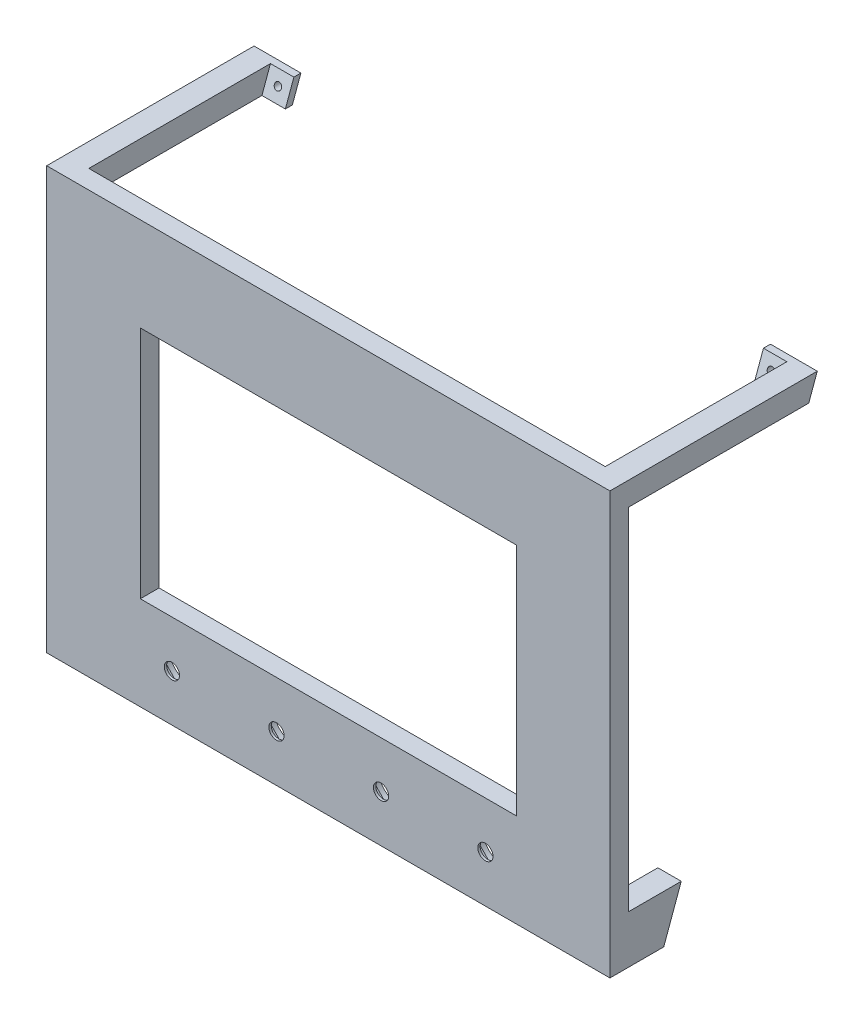
from build123d import *

# Parameters (mm, degrees)
SKETCH1_W                      = 240.6
SKETCH1_H                      = 180.2
BOSS_EXTRUDE1_DEPTH            = 8
SKETCH2_W                      = 160.6
SKETCH2_H                      = 100.2
CUT_EXTRUDE1_DEPTH             = 200.503872501
CUT_EXTRUDE2_DEPTH             = 7
CUT_EXTRUDE3_DEPTH             = 7
CUT_EXTRUDE4_DEPTH             = 7
CUT_EXTRUDE5_DEPTH             = 7
F_6_5_6_5_DIAMETER_HOLE1_D     = 6.5
F_6_5_6_5_DIAMETER_HOLE1_DEPTH = 8
SKETCH9_R                      = 9.267416037
SKETCH9_R_2                    = 9.269178346
SKETCH9_R_3                    = 9.266671768
CUT_EXTRUDE7_DEPTH             = 4
BOSS_EXTRUDE2_DEPTH            = 10
BOSS_EXTRUDE3_DEPTH            = 10
BOSS_EXTRUDE4_DEPTH            = 10
BOSS_EXTRUDE5_DEPTH            = 10
SKETCH18_W                     = 10
SKETCH18_H                     = 10.641777725
SKETCH18_R                     = 1.5
BOSS_EXTRUDE6_DEPTH            = 3


with BuildPart() as part:
    # Sketch1 → Boss-Extrude1 (new body)
    with BuildSketch(Plane(origin=(0, 0, 0), x_dir=(-1, 0, 0), z_dir=(0, 0, -1))):
        with Locations((-50.702318109, 12.34999924)):
            Rectangle(SKETCH1_W, SKETCH1_H)
    extrude(amount=-BOSS_EXTRUDE1_DEPTH)

    # Sketch2 → Cut-Extrude1 (cut, through all)
    with BuildSketch(Plane.XY.offset(8)):
        with Locations((50.702318109, 12.34999924)):
            Rectangle(SKETCH2_W, SKETCH2_H)
    extrude(amount=-CUT_EXTRUDE1_DEPTH, mode=Mode.SUBTRACT)

    # Sketch3 → Cut-Extrude2 (cut)
    with BuildSketch(Plane(origin=(0, 0, 0), x_dir=(-1, 0, 0), z_dir=(0, 0, -1))):
        Polygon((-117.686768689, -48.483328992), (-127.060792146, -58.198146757), (-117.921667286, -67.016672528), (-108.547643828, -57.301854763), align=None)
    extrude(amount=-CUT_EXTRUDE2_DEPTH, mode=Mode.SUBTRACT)

    # Sketch4 → Cut-Extrude3 (cut)
    with BuildSketch(Plane(origin=(0, 0, 0), x_dir=(-1, 0, 0), z_dir=(0, 0, -1))):
        Polygon((6.939207854, -58.198146757), (16.078332714, -67.016672528), (25.452356172, -57.301854763), (16.313231311, -48.483328992), align=None)
    extrude(amount=-CUT_EXTRUDE3_DEPTH, mode=Mode.SUBTRACT)

    # Sketch5 → Cut-Extrude4 (cut)
    with BuildSketch(Plane(origin=(0, 0, 0), x_dir=(-1, 0, 0), z_dir=(0, 0, -1))):
        Polygon((-37.727458813, -58.198146757), (-28.588333952, -67.016672528), (-19.214310494, -57.301854763), (-28.353435355, -48.483328992), align=None)
    extrude(amount=-CUT_EXTRUDE4_DEPTH, mode=Mode.SUBTRACT)

    # Sketch6 → Cut-Extrude5 (cut)
    with BuildSketch(Plane(origin=(0, 0, 0), x_dir=(-1, 0, 0), z_dir=(0, 0, -1))):
        Polygon((-82.39412548, -58.198146757), (-73.255000619, -67.016672528), (-63.880977161, -57.301854763), (-73.020102022, -48.483328992), align=None)
    extrude(amount=-CUT_EXTRUDE5_DEPTH, mode=Mode.SUBTRACT)

    # Ø6.5 (6.5) Diameter Hole1
    with Locations(Plane.XY.offset(8)):
        with Locations((117.804217987, -57.75000076), (-16.097681891, -57.75000076), (28.568984776, -57.75000076), (73.235651442, -57.75000076)):
            Hole(F_6_5_6_5_DIAMETER_HOLE1_D / 2, depth=F_6_5_6_5_DIAMETER_HOLE1_DEPTH)

    # Sketch9 → Cut-Extrude7 (cut)
    with BuildSketch(Plane(origin=(0, 0, 0), x_dir=(-1, 0, 0), z_dir=(0, 0, -1))):
        with Locations((-117.804217987, -57.75000076)):
            Circle(SKETCH9_R)
        with Locations((-73.235651442, -57.75000076)):
            Circle(SKETCH9_R_2)
        with Locations((-28.568984776, -57.75000076)):
            Circle(SKETCH9_R_2)
        with Locations((16.097681891, -57.75000076)):
            Circle(SKETCH9_R_3)
    extrude(amount=-CUT_EXTRUDE7_DEPTH, mode=Mode.SUBTRACT)

    # Sketch12 → Boss-Extrude2 (add)
    with BuildSketch(Plane(origin=(171.002318109, 0, 0), x_dir=(0, 0, -1), z_dir=(1, 0, 0))):
        Polygon((0, -77.75000076), (15, -77.75000076), (22.478199259, -57.203817156), (0, -57.203817156), align=None)
    extrude(amount=-BOSS_EXTRUDE2_DEPTH)

    # Sketch14 → Boss-Extrude3 (add)
    with BuildSketch(Plane.ZY.offset(69.597681891)):
        Polygon((-22.478199259, -57.203817156), (-15, -77.75000076), (0, -77.75000076), (0, -57.203817156), align=None)
    extrude(amount=-BOSS_EXTRUDE3_DEPTH)

    # Sketch15 → Boss-Extrude4 (add)
    with BuildSketch(Plane.ZY.offset(69.597681891)):
        Polygon((0, 102.44999924), (-80.587436215, 102.44999924), (-76.947733872, 92.44999924), (0, 92.44999924), align=None)
    extrude(amount=-BOSS_EXTRUDE4_DEPTH)

    # Sketch16 → Boss-Extrude5 (add)
    with BuildSketch(Plane(origin=(171.002318109, 0, 0), x_dir=(0, 0, -1), z_dir=(1, 0, 0))):
        Polygon((0, 102.44999924), (80.587436215, 102.44999924), (76.947733872, 92.44999924), (0, 92.44999924), align=None)
    extrude(amount=-BOSS_EXTRUDE5_DEPTH)

    # Sketch18 → Boss-Extrude6 (add, along a direction that is not the sketch's normal)
    # profile 1 of 2: a face of its own
    with BuildSketch(Plane(origin=(0, -13.915929435, -38.233701894), x_dir=(-1, 0, 0), z_dir=(0, -0.3420201433256657, -0.9396926207859096))):
        with Locations((54.597681891, 118.513145908)):
            Rectangle(SKETCH18_W, SKETCH18_H)
        with Locations((54.597681891, 118.513145907)):
            Circle(SKETCH18_R, mode=Mode.SUBTRACT)
    # profile 2 of 2: a face of its own
    with BuildSketch(Plane(origin=(0, -13.915929435, -38.233701894), x_dir=(-1, 0, 0), z_dir=(0, -0.3420201433256657, -0.9396926207859096))):
        with Locations((-156.002318109, 118.513145908)):
            Rectangle(SKETCH18_W, SKETCH18_H)
        with Locations((-156.002318109, 118.513145907)):
            Circle(SKETCH18_R, mode=Mode.SUBTRACT)
    extrude(amount=-BOSS_EXTRUDE6_DEPTH, dir=(0, 0, -1))


solid = part.part
